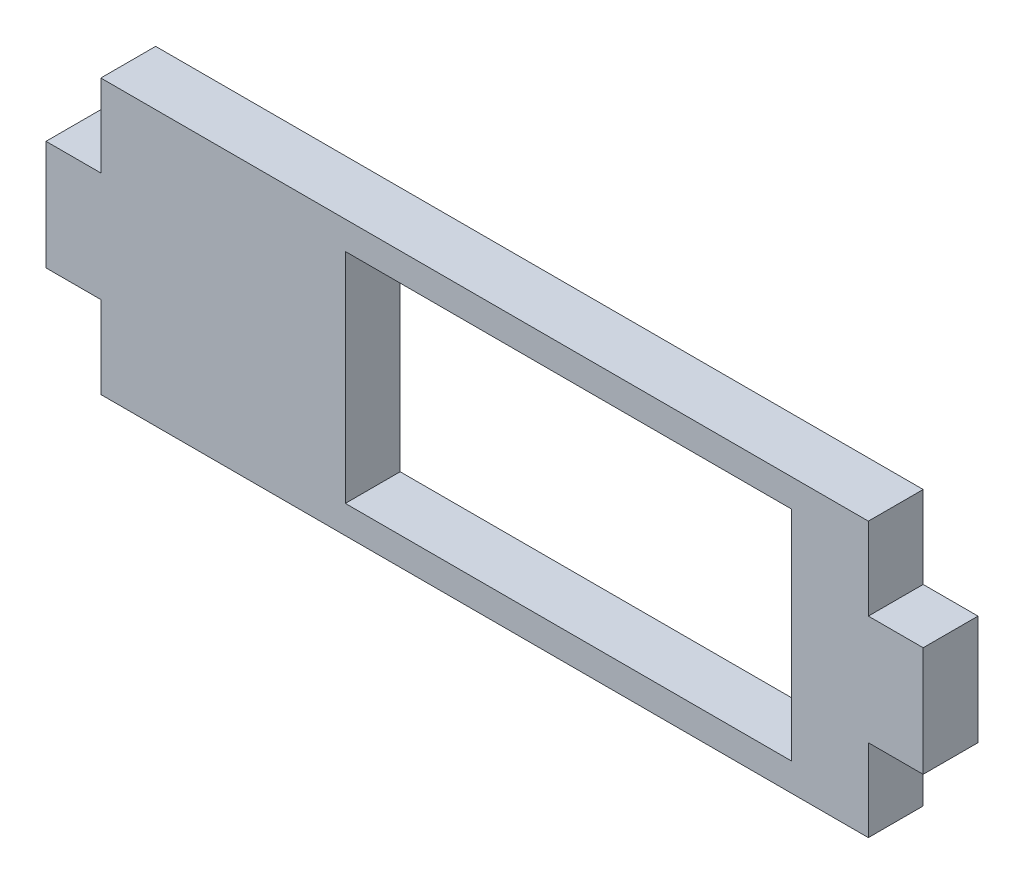
from build123d import *

# Parameters (mm, degrees)
EXTRUDE_1_DEPTH     = 5
SKETCH_2_W          = 40.7
SKETCH_2_H          = 19.9
CUT_EXTRUDE_1_DEPTH = 43.20485754


with BuildPart() as part:
    # 스케치1 → 보스-돌출1 (new body)
    with BuildSketch(Plane.XY):
        Polygon((-40, 5), (-40, -5), (-35, -5), (-35, -12.5), (35, -12.5), (35, -5), (40, -5), (40, 5), (35, 5), (35, 12.5), (-35, 12.5), (-35, 5), align=None)
    extrude(amount=EXTRUDE_1_DEPTH)

    # 스케치2 → 컷-돌출1 (cut, through all)
    with BuildSketch(Plane.XY.offset(5)):
        with Locations((7.65, 0)):
            Rectangle(SKETCH_2_W, SKETCH_2_H)
    extrude(amount=-CUT_EXTRUDE_1_DEPTH, mode=Mode.SUBTRACT)


solid = part.part
